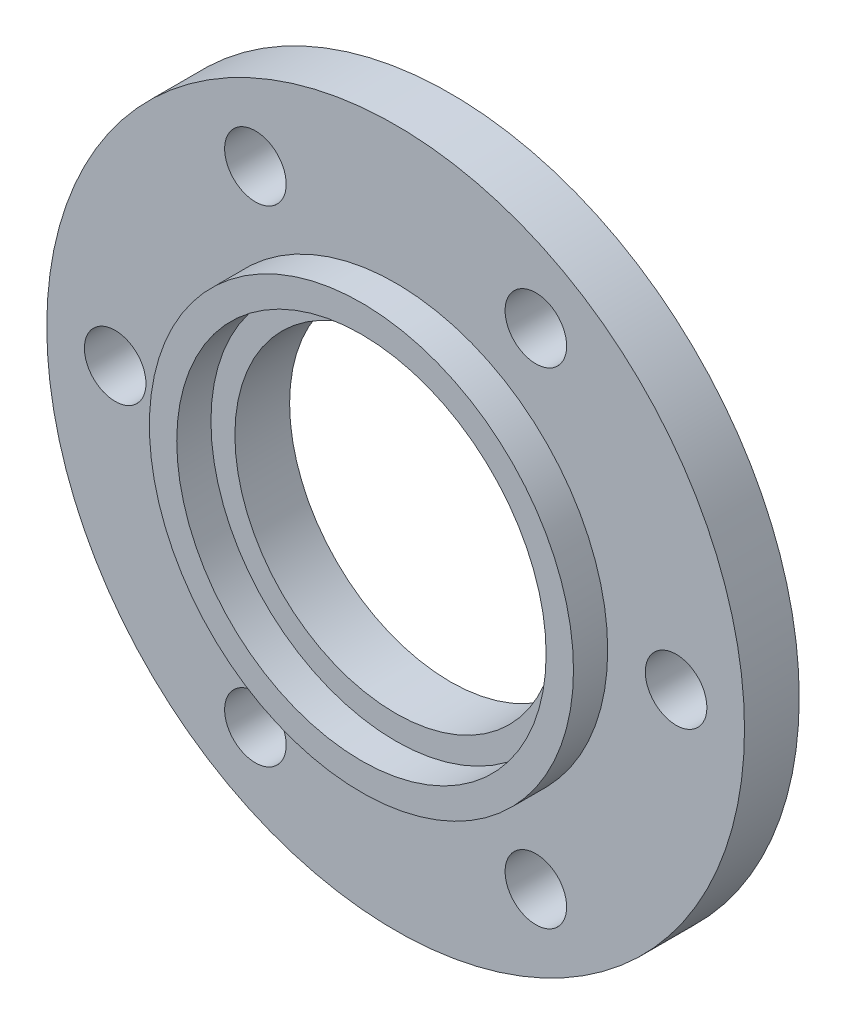
from build123d import *

# Parameters (mm, degrees)
SKETCH_1_R          = 51
SKETCH_1_R_2        = 23.5
EXTRUDE_1_DEPTH     = 8
SKETCH_2_R          = 31
SKETCH_2_R_2        = 27
EXTRUDE_2_DEPTH     = 5
CUT_EXTRUDE_1_REACH = 74.567
SKETCH_3_R          = 4.5


with BuildPart() as part:
    # 草图1 → 凸台-拉伸1 (new body)
    with BuildSketch(Plane.XY):
        Circle(SKETCH_1_R)
        Circle(SKETCH_1_R_2, mode=Mode.SUBTRACT)
    extrude(amount=EXTRUDE_1_DEPTH)

    # 草图2 → 凸台-拉伸2 (add)
    with BuildSketch(Plane.XY.offset(8)):
        Circle(SKETCH_2_R)
        Circle(SKETCH_2_R_2, mode=Mode.SUBTRACT)
    extrude(amount=EXTRUDE_2_DEPTH)

    # 草图3 → 切除-拉伸1 (cut, up to next)
    with BuildSketch(Plane.XY.offset(8), mode=Mode.PRIVATE) as cut_extrude_1_sk1:
        with Locations((41, 0)):
            Circle(SKETCH_3_R)
    cut_extrude_1_tool1 = extrude(cut_extrude_1_sk1.sketch, amount=-CUT_EXTRUDE_1_REACH, mode=Mode.PRIVATE) & part.part
    # 草图3 → 切除-拉伸1 (cut, up to next)
    with BuildSketch(Plane.XY.offset(8), mode=Mode.PRIVATE) as cut_extrude_1_sk2:
        with Locations((20.5, -35.507041555)):
            Circle(SKETCH_3_R)
    cut_extrude_1_tool2 = extrude(cut_extrude_1_sk2.sketch, amount=-CUT_EXTRUDE_1_REACH, mode=Mode.PRIVATE) & part.part
    # 草图3 → 切除-拉伸1 (cut, up to next)
    with BuildSketch(Plane.XY.offset(8), mode=Mode.PRIVATE) as cut_extrude_1_sk3:
        with Locations((-20.5, -35.507041555)):
            Circle(SKETCH_3_R)
    cut_extrude_1_tool3 = extrude(cut_extrude_1_sk3.sketch, amount=-CUT_EXTRUDE_1_REACH, mode=Mode.PRIVATE) & part.part
    # 草图3 → 切除-拉伸1 (cut, up to next)
    with BuildSketch(Plane.XY.offset(8), mode=Mode.PRIVATE) as cut_extrude_1_sk4:
        with Locations((-41, 0)):
            Circle(SKETCH_3_R)
    cut_extrude_1_tool4 = extrude(cut_extrude_1_sk4.sketch, amount=-CUT_EXTRUDE_1_REACH, mode=Mode.PRIVATE) & part.part
    # 草图3 → 切除-拉伸1 (cut, up to next)
    with BuildSketch(Plane.XY.offset(8), mode=Mode.PRIVATE) as cut_extrude_1_sk5:
        with Locations((-20.5, 35.507041555)):
            Circle(SKETCH_3_R)
    cut_extrude_1_tool5 = extrude(cut_extrude_1_sk5.sketch, amount=-CUT_EXTRUDE_1_REACH, mode=Mode.PRIVATE) & part.part
    # 草图3 → 切除-拉伸1 (cut, up to next)
    with BuildSketch(Plane.XY.offset(8), mode=Mode.PRIVATE) as cut_extrude_1_sk6:
        with Locations((20.5, 35.507041555)):
            Circle(SKETCH_3_R)
    cut_extrude_1_tool6 = extrude(cut_extrude_1_sk6.sketch, amount=-CUT_EXTRUDE_1_REACH, mode=Mode.PRIVATE) & part.part
    add(cut_extrude_1_tool1.solids().sort_by_distance((41, 0, 8))[0], mode=Mode.SUBTRACT)
    add(cut_extrude_1_tool2.solids().sort_by_distance((20.5, -35.507042, 8))[0], mode=Mode.SUBTRACT)
    add(cut_extrude_1_tool3.solids().sort_by_distance((-20.5, -35.507042, 8))[0], mode=Mode.SUBTRACT)
    add(cut_extrude_1_tool4.solids().sort_by_distance((-41, 0, 8))[0], mode=Mode.SUBTRACT)
    add(cut_extrude_1_tool5.solids().sort_by_distance((-20.5, 35.507042, 8))[0], mode=Mode.SUBTRACT)
    add(cut_extrude_1_tool6.solids().sort_by_distance((20.5, 35.507042, 8))[0], mode=Mode.SUBTRACT)


solid = part.part
